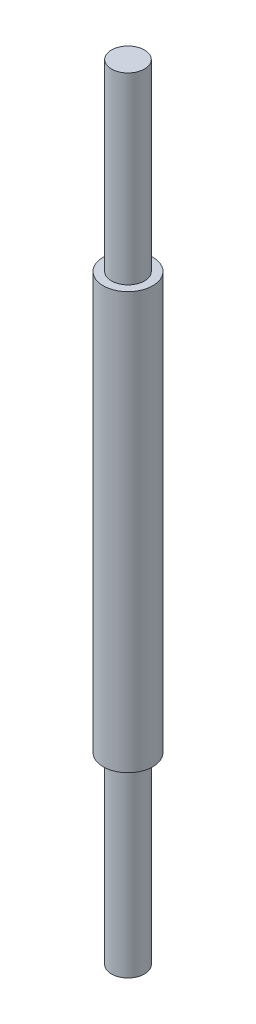
from build123d import *

# Parameters (mm, degrees)
SKETCH1_R           = 4
BOSS_EXTRUDE1_DEPTH = 95
SKETCH1_3_R         = 6
SKETCH1_3_R_2       = 4
BOSS_EXTRUDE2_DEPTH = 50.5


with BuildPart() as part:
    # Sketch1 → Boss-Extrude1 (new, symmetric)
    with BuildSketch(Plane(origin=(0, 0, 0), x_dir=(1, 0, 0), z_dir=(0, 1, 0))):
        Circle(SKETCH1_R)
    extrude(amount=BOSS_EXTRUDE1_DEPTH, both=True)

    # Sketch1<3> → Boss-Extrude2 (add, symmetric)
    with BuildSketch(Plane(origin=(0, 0, 0), x_dir=(1, 0, 0), z_dir=(0, 1, 0))):
        Circle(SKETCH1_3_R)
        Circle(SKETCH1_3_R_2, mode=Mode.SUBTRACT)
    extrude(amount=BOSS_EXTRUDE2_DEPTH, both=True)


solid = part.part
